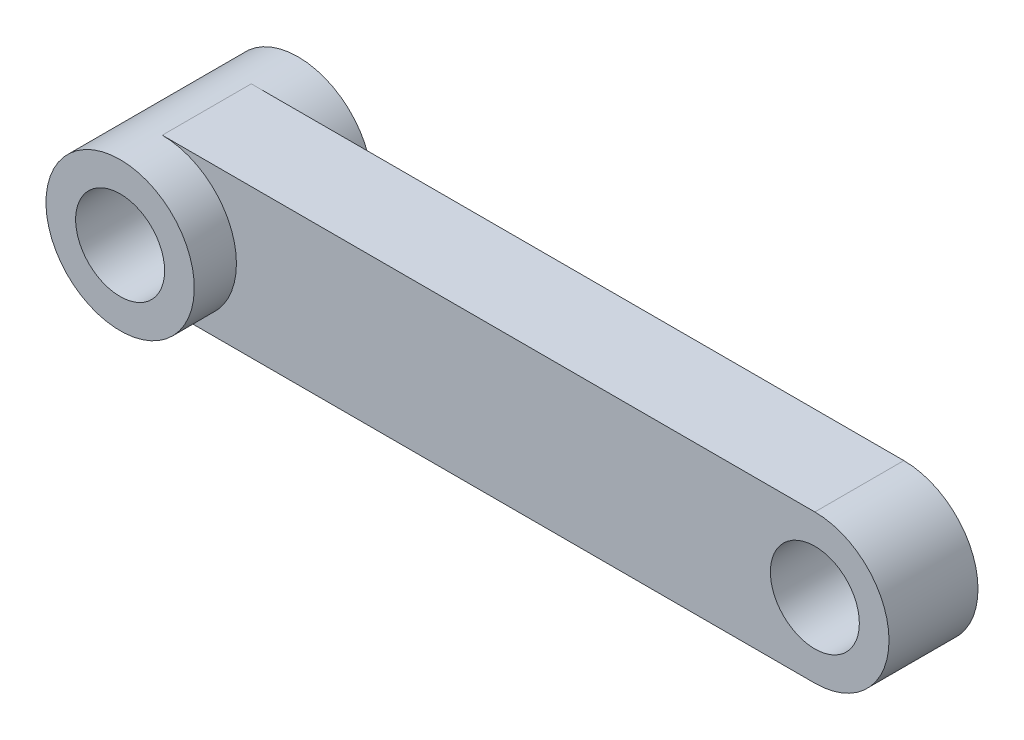
from build123d import *
from build123d.topology import SkipClean

# Parameters (mm, degrees)
CROQUIS1_R                   = 2.5
CROQUIS1_R_2                 = 1.5
SALIENTE_EXTRUIR1_DEPTH      = 3
SALIENTE_EXTRUIR2_DEPTH      = 3.078873
SALIENTE_EXTRUIR2_DEPTH_BACK = 2.921127
CROQUIS2_R                   = 2.5
CROQUIS2_R_2                 = 1.5


with BuildPart() as part:
    # Croquis1 → Saliente-Extruir1 (new body)
    # profile 1 of 3: a face of its own
    with BuildSketch(Plane.XY):
        with BuildLine():
            Line((191.551801515, -27.168993214), (169.551801515, -27.168993214))
            ThreePointArc((169.551801515, -27.168993214), (171.319568468, -27.901226261), (172.051801515, -29.668993214))
            ThreePointArc((172.051801515, -29.668993214), (171.319568468, -31.436760167), (169.551801515, -32.168993214))
            Line((169.551801515, -32.168993214), (191.551801515, -32.168993214))
            ThreePointArc((191.551801515, -32.168993214), (189.051801515, -29.668993214), (191.551801515, -27.168993214))
        make_face()
    # profile 2 of 3: a face of its own
    with BuildSketch(Plane.XY):
        with Locations((191.551801515, -29.668993214)):
            Circle(CROQUIS1_R)
        with Locations((191.551801515, -29.668993214)):
            Circle(CROQUIS1_R_2, mode=Mode.SUBTRACT)
    # profile 3 of 3: a face of its own
    with BuildSketch(Plane.XY):
        with Locations((169.551801515, -29.668993214)):
            Circle(CROQUIS1_R)
        with Locations((169.551801515, -29.668993214)):
            Circle(CROQUIS1_R_2, mode=Mode.SUBTRACT)
    extrude(amount=SALIENTE_EXTRUIR1_DEPTH)

    # Croquis2 → Saliente-Extruir2 (add, two sides: drawn at the far end of the back side and taken through both)
    with SkipClean():  # the faces are left unmerged after this step: merging them gives an invalid solid
        with BuildSketch(Plane(origin=(0, 0, 1.5), x_dir=(-1, 0, 0), z_dir=(0, 0, -1)).offset(-SALIENTE_EXTRUIR2_DEPTH_BACK)):
            with Locations(Location((-169.551801515, -29.668993214, 0), (0, 0, 90))):
                Circle(CROQUIS2_R)
            with Locations(Location((-169.551801515, -29.668993214, 0), (0, 0, 286.214321969))):
                Circle(CROQUIS2_R_2, mode=Mode.SUBTRACT)
        extrude(amount=SALIENTE_EXTRUIR2_DEPTH + SALIENTE_EXTRUIR2_DEPTH_BACK)


solid = part.part
